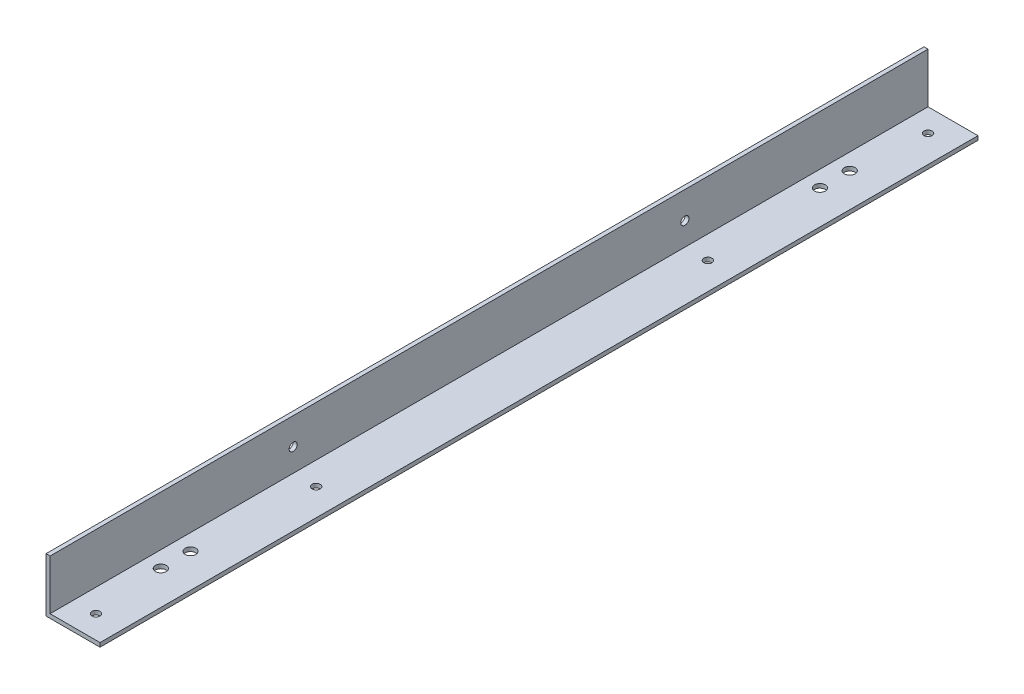
from build123d import *

# Parameters (mm, degrees)
EXTRUSION1_DEPTH = 325
ESQUISSE2_R      = 1.5
ESQUISSE2_R_2    = 2
EXTRUSION2_DEPTH = 300
ESQUISSE3_R      = 1.5
EXTRUSION3_DEPTH = 10


with BuildPart() as part:
    # Esquisse1 → Extrusion1 (new body)
    with BuildSketch(Plane.XY):
        Polygon((-17.43168638, 4.773368421), (-17.43168638, -15.226631579), (2.56831362, -15.226631579), (2.56831362, -13.726631579), (-15.93168638, -13.726631579), (-15.93168638, 4.773368421), align=None)
    extrude(amount=EXTRUSION1_DEPTH)

    # Esquisse2 → Extrusion2 (cut)
    with BuildSketch(Plane(origin=(0, -13.726631579, 0), x_dir=(-1, 0, 0), z_dir=(0, 1, 0))):
        with Locations((7.43168638, 8.5)):
            Circle(ESQUISSE2_R)
        with Locations((7.43168638, 316.5)):
            Circle(ESQUISSE2_R)
        with Locations((9.93168638, 35)):
            Circle(ESQUISSE2_R_2)
        with Locations((9.93168638, 46)):
            Circle(ESQUISSE2_R_2)
        with Locations((9.93168638, 290)):
            Circle(ESQUISSE2_R_2)
        with Locations((9.93168638, 279)):
            Circle(ESQUISSE2_R_2)
        with Locations((7.43168638, 235)):
            Circle(ESQUISSE2_R)
        with Locations((7.43168638, 90)):
            Circle(ESQUISSE2_R)
    extrude(amount=-EXTRUSION2_DEPTH, mode=Mode.SUBTRACT)

    # Esquisse3 → Extrusion3 (cut)
    with BuildSketch(Plane.ZY.offset(17.43168638)):
        with Locations(Location((235, -5.226631579, 0), (0, 0, 270))):
            Circle(ESQUISSE3_R)
        with Locations(Location((90, -5.226631579, 0), (0, 0, 270))):
            Circle(ESQUISSE3_R)
    extrude(amount=-EXTRUSION3_DEPTH, mode=Mode.SUBTRACT)


solid = part.part
